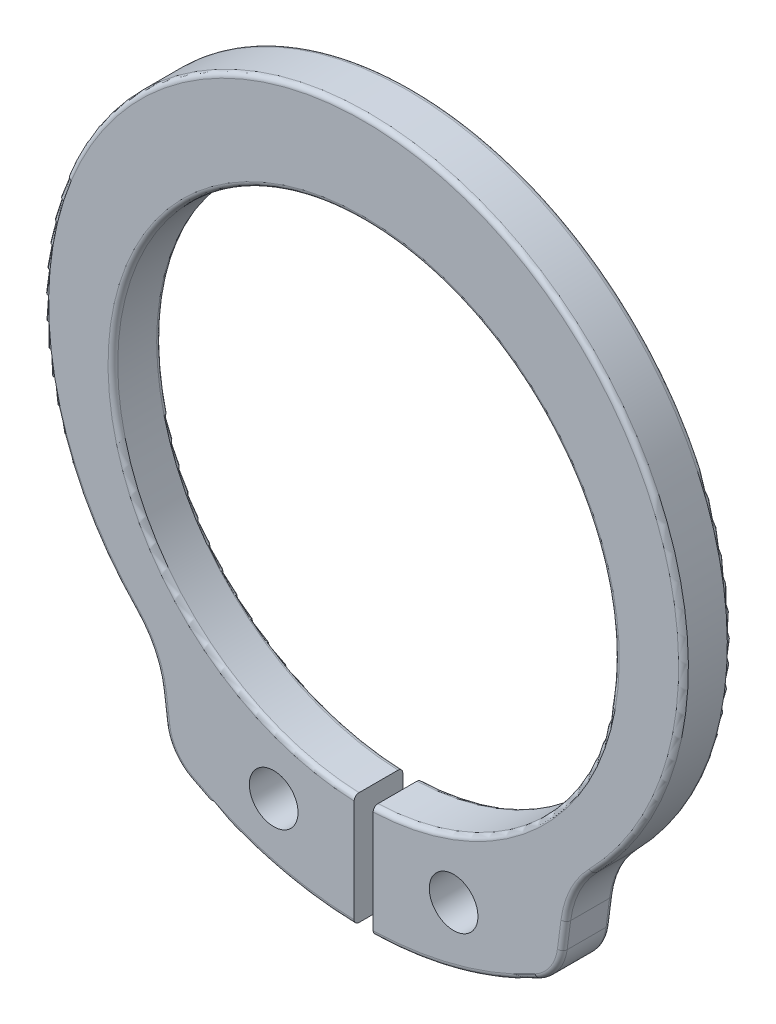
from build123d import *

# Parameters (mm, degrees)
SKETCH3_R           = 0.9906
BOSS_EXTRUDE1_DEPTH = 0.9906
FILLET1_R           = 3.9624
FILLET2_R           = 1.9812
FILLET3_R           = 0.19812


with BuildPart() as part:
    # Sketch3 → Boss-Extrude1 (new, symmetric)
    with BuildSketch(Plane.XY):
        with BuildLine():
            Line((-7.963913355, -12.460220996), (-8.414612562, -8.997336074))
            ThreePointArc((-8.414612562, -8.997336074), (-12.230129097, 5.425677886), (0, 13.97))
            Line((0, 13.97), (0, 10.2108))
            ThreePointArc((0, 10.2108), (-10.208964753, 0.193585415), (-0.387101241, -10.203459672))
            Line((-0.387101241, -10.203459672), (-0.387101241, -14.7828))
            ThreePointArc((-0.387101241, -14.7828), (-4.333988291, -14.138513667), (-7.963913355, -12.460220996))
        make_face()
        with Locations((-3.663271004, -11.95047233)):
            Circle(SKETCH3_R, mode=Mode.SUBTRACT)
    extrude(amount=BOSS_EXTRUDE1_DEPTH, both=True)

    # Fillet1
    fillet1_edges = [part.edges().sort_by_distance(p)[0] for p in [
        (-8.414612562, -8.997336074, 0),
    ]]
    fillet(fillet1_edges, radius=FILLET1_R)

    # Fillet2
    fillet2_edges = [part.edges().sort_by_distance(p)[0] for p in [
        (-7.963913355, -12.460220996, 0),
    ]]
    fillet(fillet2_edges, radius=FILLET2_R)

    # Mirror1: part across plane


with BuildPart() as part_1:
    add(part.part)
    add(part.part.mirror(Plane(origin=(0, 13.97, 0.9906), x_dir=(0, 0, 1), z_dir=(-1, 0, 0))))

    # Fillet3
    fillet3_edges = [part_1.edges().sort_by_distance(p)[0] for p in [
        (-10.208964753, 0.193585415, 0.9906),
        (-8.159915946, -10.954262245, -0.9906),
        (-8.159915946, -10.954262245, 0.9906),
        (-8.594751987, -9.188846365, -0.9906),
        (-8.594751987, -9.188846365, 0.9906),
        (-3.835638548, -14.281768103, -0.9906),
        (-3.835638548, -14.281768103, 0.9906),
        (-7.758056172, -12.367660081, -0.9906),
        (-7.758056172, -12.367660081, 0.9906),
        (-12.002363858, 6.004215822, 0.9906),
        (3.835638548, -14.281768103, -0.9906),
        (8.159915946, -10.954262245, -0.9906),
        (8.159915946, -10.954262245, 0.9906),
        (3.835638548, -14.281768103, 0.9906),
        (8.594751987, -9.188846365, 0.9906),
        (8.594751987, -9.188846365, -0.9906),
        (7.758056172, -12.367660081, 0.9906),
        (7.758056172, -12.367660081, -0.9906),
        (-10.208964753, 0.193585415, -0.9906),
        (-12.002363858, 6.004215822, -0.9906),
    ]]
    fillet(fillet3_edges, radius=FILLET3_R)


solid = part_1.part
